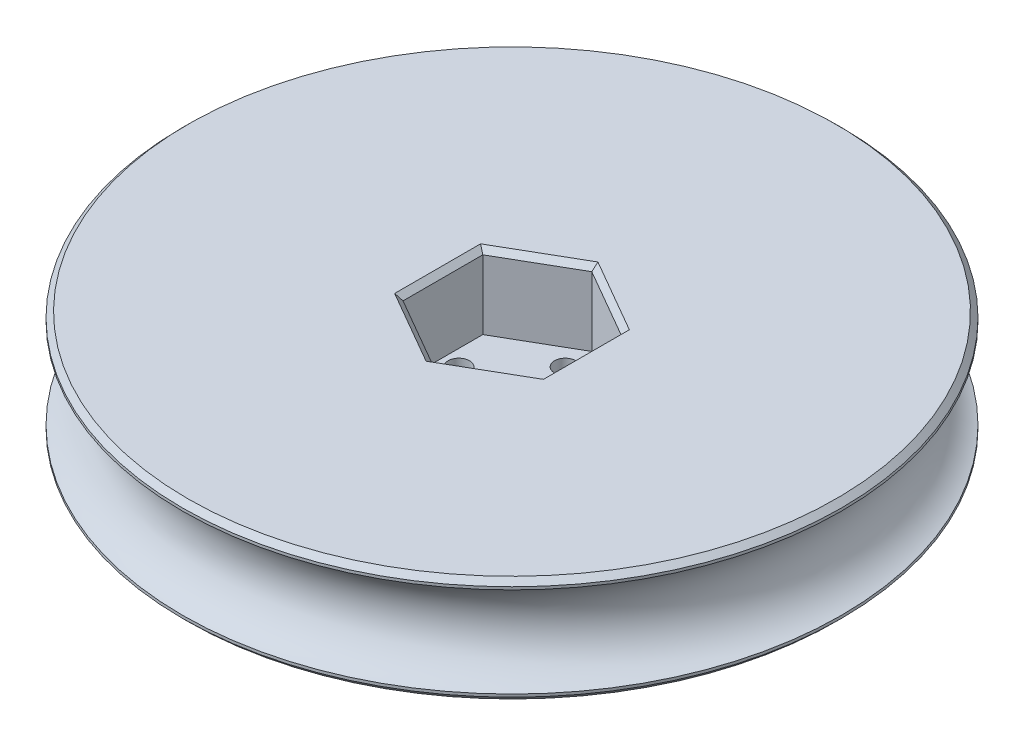
from build123d import *

# Parameters (mm, degrees)
SKETCH_1_R          = 62
EXTRUDE_1_DEPTH     = 20
SKETCH_3_R          = 9
CHAMFER_3_SIZE      = 1
CUT_EXTRUDE_2_DEPTH = 14
SKETCH_6_R          = 2
CUT_EXTRUDE_3_DEPTH = 90.933308624
CHAMFER_2_SIZE      = 1
CHAMFER_4_SIZE      = 2


with BuildPart() as part:
    # Эскиз1 → Бобышка-Вытянуть1 (new body)
    with BuildSketch(Plane(origin=(0, 0, 0), x_dir=(1, 0, 0), z_dir=(0, 1, 0))):
        with Locations(Location((0, 0, 0), (0, 0, 270))):
            Circle(SKETCH_1_R)
    extrude(amount=EXTRUDE_1_DEPTH)

    # Эскиз3 → Вырез-Повернуть2 (revolve, cut)
    with BuildSketch(Plane.XY, mode=Mode.PRIVATE) as cut_revolve_2_sk:
        with Locations((-65, 10)):
            Circle(SKETCH_3_R)
    revolve(cut_revolve_2_sk.sketch.rotate(Axis((0, 0, 0), (0, 1, 0)), 180), axis=Axis((0, 0, 0), (0, 1, 0)), mode=Mode.SUBTRACT)

    # Фаска3
    chamfer_3_edges = [part.edges().sort_by_distance(p)[0] for p in [
        (0, 0, -62),
    ]]
    chamfer(chamfer_3_edges, length=CHAMFER_3_SIZE)

    # Эскиз5 → Вырез-Вытянуть2 (cut)
    with BuildSketch(Plane(origin=(0, 20, 0), x_dir=(1, 0, 0), z_dir=(0, 1, 0))):
        Polygon((0, 15.011106999), (-13, 7.505553499), (-13, -7.505553499), (0, -15.011106999), (13, -7.505553499), (13, 7.505553499), align=None)
    extrude(amount=-CUT_EXTRUDE_2_DEPTH, mode=Mode.SUBTRACT)

    # Эскиз6 → Вырез-Вытянуть3 (cut, through all)
    with BuildSketch(Plane(origin=(0, 20, 0), x_dir=(1, 0, 0), z_dir=(0, 1, 0))):
        with Locations(Location((0, 10, 0), (0, 0, 270))):
            Circle(SKETCH_6_R)
        with Locations(Location((10, 0, 0), (0, 0, 270))):
            Circle(SKETCH_6_R)
        with Locations(Location((0, -10, 0), (0, 0, 270))):
            Circle(SKETCH_6_R)
        with Locations(Location((-10, 0, 0), (0, 0, 270))):
            Circle(SKETCH_6_R)
    extrude(amount=-CUT_EXTRUDE_3_DEPTH, mode=Mode.SUBTRACT)

    # Фаска2
    chamfer_2_edges = [part.edges().sort_by_distance(p)[0] for p in [
        (6.5, 20, -11.258330249),
        (-6.5, 20, -11.258330249),
        (-13, 20, 0),
        (-6.5, 20, 11.258330249),
        (6.5, 20, 11.258330249),
        (13, 20, 0),
        (0, 20, -62),
    ]]
    chamfer(chamfer_2_edges, length=CHAMFER_2_SIZE)

    # Фаска4
    chamfer_4_edges = [part.edges().sort_by_distance(p)[0] for p in [
        (0, 0, -12),
        (10, 0, -2),
        (0, 0, 8),
        (-10, 0, -2),
    ]]
    chamfer(chamfer_4_edges, length=CHAMFER_4_SIZE)


solid = part.part
